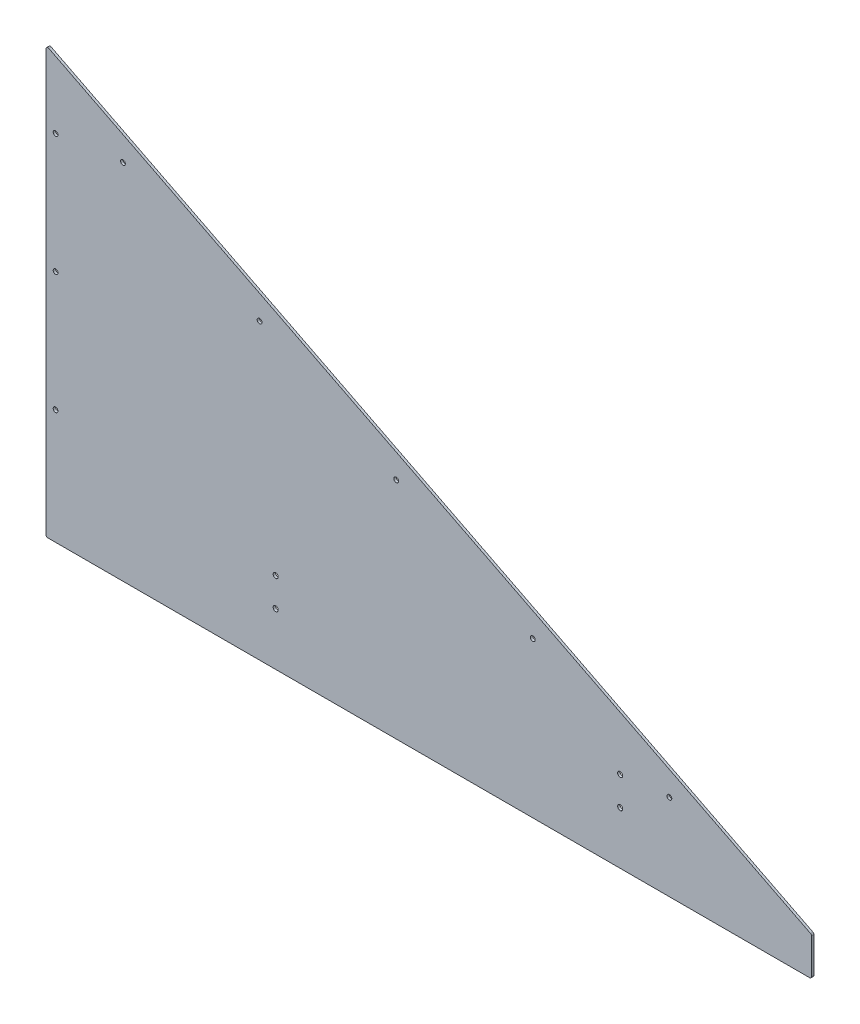
from build123d import *

# Parameters (mm, degrees)
BOSS_EXTRUDE1_DEPTH              = 3.175
F_1_4_0_25_DIAMETER_HOLE1_D      = 6.35
F_17_64_0_26563_DIAMETER_HOLE1_D = 6.747002
FILLET1_R                        = 2.54
F_1_4_0_25_DIAMETER_HOLE2_D      = 6.35


with BuildPart() as part:
    # Sketch1 → Boss-Extrude1 (new body)
    with BuildSketch(Plane.XY):
        Polygon((-1016, 514.35), (-1016, -50.8), (0, -50.8), (0, 0), align=None)
    extrude(amount=BOSS_EXTRUDE1_DEPTH)

    # 1/4 (0.25) Diameter Hole1 (through all)
    with Locations(Plane.XY.offset(3.175)):
        with Locations((-1003.3, 419.1), (-1003.3, 260.35), (-1003.3, 101.6)):
            Hole(F_1_4_0_25_DIAMETER_HOLE1_D / 2)

    # 17/64 (0.26563) Diameter Hole1 (through all)
    with Locations(Plane.XY.offset(3.175)):
        with Locations((-254, 19.05), (-711.2, 57.15), (-711.2, 19.05), (-254, 57.15)):
            Hole(F_17_64_0_26563_DIAMETER_HOLE1_D / 2)

    # Fillet1
    fillet1_edges = [part.edges().sort_by_distance(p)[0] for p in [
        (0, 0, 1.5875),
        (0, -50.8, 1.5875),
        (-1016, -50.8, 1.5875),
        (-1016, 514.35, 1.5875),
    ]]
    fillet(fillet1_edges, radius=FILLET1_R)

    # 1/4 (0.25) Diameter Hole2 (through all)
    with Locations(Plane.XY.offset(3.175)):
        with Locations((-913.865917768, 430.616531739), (-732.573803329, 338.837398804), (-188.697460012, 63.5), (-369.989574451, 155.279132935), (-551.28168889, 247.058265869)):
            Hole(F_1_4_0_25_DIAMETER_HOLE2_D / 2)


solid = part.part
